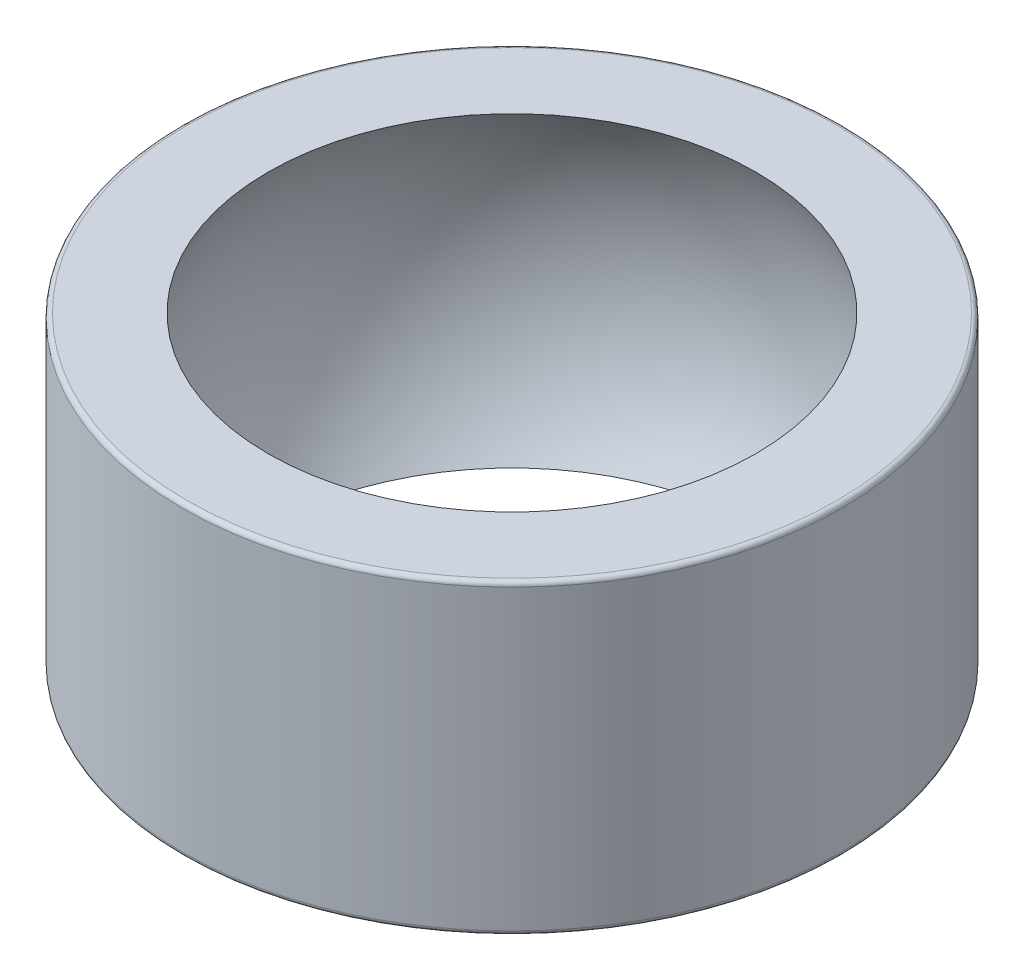
from build123d import *

# Parameters (mm, degrees)
SZKIC1_R                    = 14.5
DODANIE_WYCI_GNI_CIE1_DEPTH = 6.75
ZAOKR_GLENIE1_R             = 0.2


with BuildPart() as part:
    # Szkic1 → Dodanie-wyciągnięcie1 (new, symmetric)
    with BuildSketch(Plane(origin=(0, 0, 0), x_dir=(1, 0, 0), z_dir=(0, 1, 0))):
        with Locations(Location((0, 0, 0), (0, 0, 270))):
            Circle(SZKIC1_R)
    extrude(amount=DODANIE_WYCI_GNI_CIE1_DEPTH, both=True)

    # Szkic3 → Wycięcie-obrót1 (revolve, cut)
    with BuildSketch(Plane.XY):
        with BuildLine():
            Line((0, -12.68), (0, 12.68))
            ThreePointArc((0, 12.68), (12.68, 0), (0, -12.68))
        make_face()
    revolve(axis=Axis((0, -12.68, 0), (0, 1, 0)), mode=Mode.SUBTRACT)

    # Zaokrąglenie1
    zaokr_glenie1_edges = [part.edges().sort_by_distance(p)[0] for p in [
        (0, -6.75, -14.5),
        (0, 6.75, -14.5),
    ]]
    fillet(zaokr_glenie1_edges, radius=ZAOKR_GLENIE1_R)


solid = part.part
